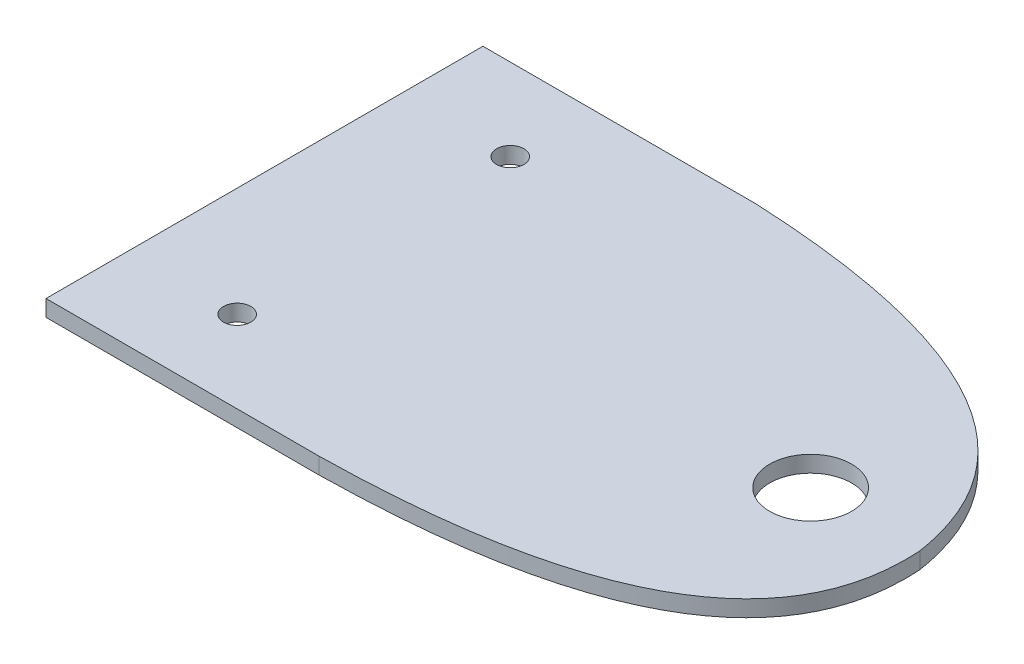
from build123d import *

# Parameters (mm, degrees)
SKETCH1_R           = 2.5
SKETCH1_R_2         = 7.5
BOSS_EXTRUDE1_DEPTH = 3


with BuildPart() as part:
    # Sketch1 → Boss-Extrude1 (new body)
    with BuildSketch(Plane(origin=(0, 0, 0), x_dir=(1, 0, 0), z_dir=(0, 1, 0))):
        with BuildLine():
            Line((-100, 40), (-100, -40))
            Line((-100, -40), (-50, -40))
            add(Edge.make_bspline(
                [(-50, -40), (22.668262508, -38.849155335), (20, 0)],
                knots=[0, 0, 0, 0.942307838, 0.942307838, 0.942307838], degree=2))
            add(Edge.make_bspline(
                [(16.665092834, 11.057788243), (19.095873291, 5.971869908), (20, 0)],
                knots=[0.704383091, 0.704383091, 0.704383091, 0.839710595, 0.839710595, 0.839710595], degree=2))
            add(Edge.make_bspline(
                [(-50, 40), (4.01281886, 37.53012226), (16.665092834, 11.057788243)],
                knots=[0, 0, 0, 0.704383091, 0.704383091, 0.704383091], degree=2))
            Line((-50, 40), (-100, 40))
        make_face()
        with Locations(Location((-80, -25, 0), (0, 0, 270))):
            Circle(SKETCH1_R, mode=Mode.SUBTRACT)
        with Locations(Location((-80, 25, 0), (0, 0, 270))):
            Circle(SKETCH1_R, mode=Mode.SUBTRACT)
        with Locations(Location((0, 0, 0), (0, 0, 270))):
            Circle(SKETCH1_R_2, mode=Mode.SUBTRACT)
    extrude(amount=BOSS_EXTRUDE1_DEPTH)


solid = part.part
